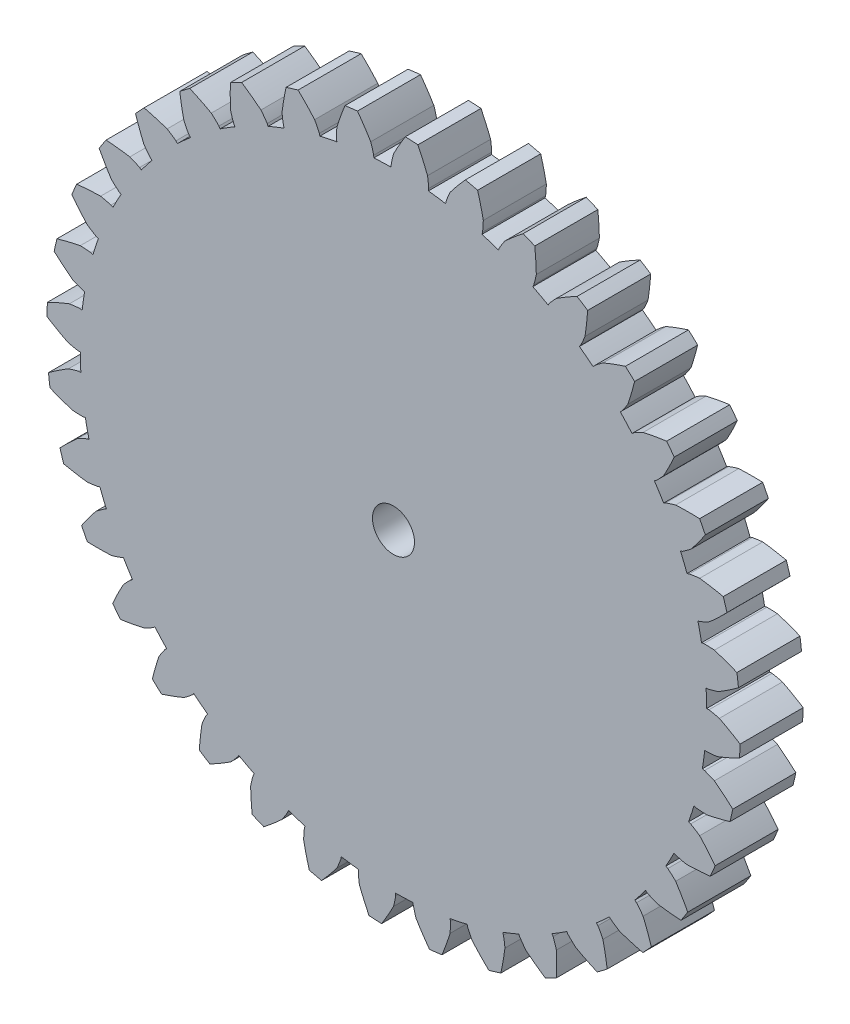
from build123d import *

# Parameters (mm, degrees)
SKETCH1_R           = 1
BOSS_EXTRUDE1_DEPTH = 1.5


with BuildPart() as part:
    # Sketch1 → Boss-Extrude1 (new, symmetric)
    with BuildSketch(Plane.XY):
        with BuildLine():
            Line((-0.105764176, 15.005915709), (-0.105764176, 14.899624624))
            ThreePointArc((-0.105764176, 14.899624624), (-0.520002501, 14.890923323), (-0.933838734, 14.870707623))
            Line((-0.933838734, 14.870707623), (-0.941253225, 14.976739788))
            ThreePointArc((-0.941253225, 14.976739788), (-1.005102521, 15.221260533), (-1.081225343, 15.462242779))
            ThreePointArc((-1.081225343, 15.462242779), (-1.386991056, 15.943446134), (-1.713561409, 16.410780216))
            ThreePointArc((-1.713561409, 16.410780216), (-2.010844166, 16.377011502), (-2.307465746, 16.337857933))
            ThreePointArc((-2.307465746, 16.337857933), (-2.511277217, 15.805401151), (-2.691546754, 15.264520172))
            ThreePointArc((-2.691546754, 15.264520172), (-2.707109521, 15.012280351), (-2.709907298, 14.759576375))
            Line((-2.709907298, 14.759576375), (-2.691450045, 14.65490009))
            ThreePointArc((-2.691450045, 14.65490009), (-3.097884193, 14.574399251), (-3.501922904, 14.482628766))
            Line((-3.501922904, 14.482628766), (-3.527637045, 14.585762551))
            ThreePointArc((-3.527637045, 14.585762551), (-3.632976909, 14.815481162), (-3.749789382, 15.039583757))
            ThreePointArc((-3.749789382, 15.039583757), (-4.134469912, 15.460380893), (-4.53723064, 15.863906774))
            ThreePointArc((-4.53723064, 15.863906774), (-4.824133128, 15.779028473), (-5.109449413, 15.688961938))
            ThreePointArc((-5.109449413, 15.688961938), (-5.21770438, 15.129202881), (-5.301312222, 14.565235622))
            ThreePointArc((-5.301312222, 14.565235622), (-5.27283757, 14.314125445), (-5.231711258, 14.064774781))
            Line((-5.231711258, 14.064774781), (-5.195357565, 13.964893833))
            ThreePointArc((-5.195357565, 13.964893833), (-5.581638242, 13.815039433), (-5.96360292, 13.654502562))
            Line((-5.96360292, 13.654502562), (-6.006835399, 13.7516043))
            ThreePointArc((-6.006835399, 13.7516043), (-6.150465131, 13.959540893), (-6.304417968, 14.159954593))
            ThreePointArc((-6.304417968, 14.159954593), (-6.756324992, 14.507559802), (-7.223038413, 14.835016551))
            ThreePointArc((-7.223038413, 14.835016551), (-7.490843246, 14.701607649), (-7.756185046, 14.563364774))
            ThreePointArc((-7.756185046, 14.563364774), (-7.765594237, 13.993311437), (-7.75, 13.423393759))
            ThreePointArc((-7.75, 13.423393759), (-7.678353117, 13.18104308), (-7.594552318, 12.942622123))
            Line((-7.594552318, 12.942622123), (-7.541406776, 12.850571343))
            ThreePointArc((-7.541406776, 12.850571343), (-7.895797037, 12.635916633), (-8.244081878, 12.411491207))
            Line((-8.244081878, 12.411491207), (-8.303519098, 12.49961051))
            ThreePointArc((-8.303519098, 12.49961051), (-8.481074583, 12.679447038), (-8.667490004, 12.850082375))
            ThreePointArc((-8.667490004, 12.850082375), (-9.172892556, 13.113933848), (-9.689377819, 13.355371858))
            ThreePointArc((-9.689377819, 13.355371858), (-9.929947882, 13.177485916), (-10.167252921, 12.99526714))
            ThreePointArc((-10.167252921, 12.99526714), (-10.077530442, 12.432240305), (-9.96320795, 11.873688868))
            ThreePointArc((-9.96320795, 11.873688868), (-9.850565791, 11.647461392), (-9.726636749, 11.427214441))
            Line((-9.726636749, 11.427214441), (-9.658314157, 11.345790746))
            ThreePointArc((-9.658314157, 11.345790746), (-9.970046035, 11.0728579), (-10.27406858, 10.791362973))
            Line((-10.27406858, 10.791362973), (-10.347904572, 10.86782238))
            ThreePointArc((-10.347904572, 10.86782238), (-10.553990875, 11.014094601), (-10.767204742, 11.149766905))
            ThreePointArc((-10.767204742, 11.149766905), (-11.310746422, 11.321847649), (-11.861310384, 11.469930949))
            ThreePointArc((-11.861310384, 11.469930949), (-12.067336077, 11.252972941), (-12.26939396, 11.032314891))
            ThreePointArc((-12.26939396, 11.032314891), (-12.083265983, 10.493421844), (-11.873688868, 9.96320795))
            ThreePointArc((-11.873688868, 9.96320795), (-11.723474008, 9.759977483), (-11.563182245, 9.56459663))
            Line((-11.563182245, 9.56459663), (-11.48175855, 9.496274038))
            ThreePointArc((-11.48175855, 9.496274038), (-11.741360229, 9.173355982), (-11.991882908, 8.843344635))
            Line((-11.991882908, 8.843344635), (-12.077874201, 8.905820967))
            ThreePointArc((-12.077874201, 8.905820967), (-12.306229495, 9.014084473), (-12.539763413, 9.110671411))
            ThreePointArc((-12.539763413, 9.110671411), (-13.104928981, 9.185752839), (-13.672843034, 9.235981993))
            ThreePointArc((-13.672843034, 9.235981993), (-13.838064371, 8.986544078), (-13.998735673, 8.734151336))
            ThreePointArc((-13.998735673, 8.734151336), (-13.721857603, 8.235766069), (-13.423393759, 7.75))
            ThreePointArc((-13.423393759, 7.75), (-13.240170399, 7.575941597), (-13.048386299, 7.411363391))
            Line((-13.048386299, 7.411363391), (-12.956335519, 7.358217849))
            ThreePointArc((-12.956335519, 7.358217849), (-13.155919134, 6.995126286), (-13.345329941, 6.626625745))
            Line((-13.345329941, 6.626625745), (-13.440863735, 6.67322069))
            ThreePointArc((-13.440863735, 6.67322069), (-13.68454956, 6.74018595), (-13.931307718, 6.794752775))
            ThreePointArc((-13.931307718, 6.794752775), (-14.500924904, 6.770553578), (-15.068933268, 6.721402397))
            ThreePointArc((-15.068933268, 6.721402397), (-15.188330082, 6.44706362), (-15.302732886, 6.170605012))
            ThreePointArc((-15.302732886, 6.170605012), (-14.943517522, 5.72787071), (-14.565235622, 5.301312222))
            ThreePointArc((-14.565235622, 5.301312222), (-14.354570913, 5.16171456), (-14.137121738, 5.032939625))
            Line((-14.137121738, 5.032939625), (-14.037240791, 4.996585933))
            ThreePointArc((-14.037240791, 4.996585933), (-14.170742093, 4.604353216), (-14.293285877, 4.208560186))
            Line((-14.293285877, 4.208560186), (-14.395459425, 4.237857979))
            ThreePointArc((-14.395459425, 4.237857979), (-14.64707151, 4.261490287), (-14.899556287, 4.272379015))
            ThreePointArc((-14.899556287, 4.272379015), (-15.456317562, 4.149634471), (-16.007161589, 4.00259639))
            ThreePointArc((-16.007161589, 4.00259639), (-16.077106069, 3.711692397), (-16.141764304, 3.419567978))
            ThreePointArc((-16.141764304, 3.419567978), (-15.711126224, 3.045936897), (-15.264520172, 2.691546754))
            ThreePointArc((-15.264520172, 2.691546754), (-15.032815053, 2.590651437), (-14.796307888, 2.501592536))
            Line((-14.796307888, 2.501592536), (-14.691631603, 2.483135283))
            ThreePointArc((-14.691631603, 2.483135283), (-14.754994224, 2.073679204), (-14.806947555, 1.662619654))
            Line((-14.806947555, 1.662619654), (-14.912656366, 1.673730098))
            ThreePointArc((-14.912656366, 1.673730098), (-15.164549604, 1.653311398), (-15.415089378, 1.620191181))
            ThreePointArc((-15.415089378, 1.620191181), (-15.942077832, 1.402630822), (-16.459020406, 1.162173517))
            ThreePointArc((-16.459020406, 1.162173517), (-16.477387323, 0.863543278), (-16.490336382, 0.564629101))
            ThreePointArc((-16.490336382, 0.564629101), (-16.001360306, 0.271453834), (-15.5, 0))
            ThreePointArc((-15.5, 0), (-15.254294715, -0.059127319), (-15.005915709, -0.105764176))
            Line((-15.005915709, -0.105764176), (-14.899624624, -0.105764176))
            ThreePointArc((-14.899624624, -0.105764176), (-14.890923323, -0.520002501), (-14.870707623, -0.933838734))
            Line((-14.870707623, -0.933838734), (-14.976739788, -0.941253225))
            ThreePointArc((-14.976739788, -0.941253225), (-15.221260533, -1.005102521), (-15.462242779, -1.081225343))
            ThreePointArc((-15.462242779, -1.081225343), (-15.943446134, -1.386991056), (-16.410780216, -1.713561409))
            ThreePointArc((-16.410780216, -1.713561409), (-16.377011502, -2.010844166), (-16.337857933, -2.307465746))
            ThreePointArc((-16.337857933, -2.307465746), (-15.805401151, -2.511277217), (-15.264520172, -2.691546754))
            ThreePointArc((-15.264520172, -2.691546754), (-15.012280351, -2.707109521), (-14.759576375, -2.709907298))
            Line((-14.759576375, -2.709907298), (-14.65490009, -2.691450045))
            ThreePointArc((-14.65490009, -2.691450045), (-14.574399251, -3.097884193), (-14.482628766, -3.501922904))
            Line((-14.482628766, -3.501922904), (-14.585762551, -3.527637045))
            ThreePointArc((-14.585762551, -3.527637045), (-14.815481162, -3.632976909), (-15.039583757, -3.749789382))
            ThreePointArc((-15.039583757, -3.749789382), (-15.460380893, -4.134469912), (-15.863906774, -4.53723064))
            ThreePointArc((-15.863906774, -4.53723064), (-15.779028473, -4.824133128), (-15.688961938, -5.109449413))
            ThreePointArc((-15.688961938, -5.109449413), (-15.129202881, -5.21770438), (-14.565235622, -5.301312222))
            ThreePointArc((-14.565235622, -5.301312222), (-14.314125445, -5.27283757), (-14.064774781, -5.231711258))
            Line((-14.064774781, -5.231711258), (-13.964893833, -5.195357565))
            ThreePointArc((-13.964893833, -5.195357565), (-13.815039433, -5.581638242), (-13.654502562, -5.96360292))
            Line((-13.654502562, -5.96360292), (-13.7516043, -6.006835399))
            ThreePointArc((-13.7516043, -6.006835399), (-13.959540893, -6.150465131), (-14.159954593, -6.304417968))
            ThreePointArc((-14.159954593, -6.304417968), (-14.507559802, -6.756324992), (-14.835016551, -7.223038413))
            ThreePointArc((-14.835016551, -7.223038413), (-14.701607649, -7.490843246), (-14.563364774, -7.756185046))
            ThreePointArc((-14.563364774, -7.756185046), (-13.993311437, -7.765594237), (-13.423393759, -7.75))
            ThreePointArc((-13.423393759, -7.75), (-13.18104308, -7.678353117), (-12.942622123, -7.594552318))
            Line((-12.942622123, -7.594552318), (-12.850571343, -7.541406776))
            ThreePointArc((-12.850571343, -7.541406776), (-12.635916633, -7.895797037), (-12.411491207, -8.244081878))
            Line((-12.411491207, -8.244081878), (-12.49961051, -8.303519098))
            ThreePointArc((-12.49961051, -8.303519098), (-12.679447038, -8.481074583), (-12.850082375, -8.667490004))
            ThreePointArc((-12.850082375, -8.667490004), (-13.113933848, -9.172892556), (-13.355371858, -9.689377819))
            ThreePointArc((-13.355371858, -9.689377819), (-13.177485916, -9.929947882), (-12.99526714, -10.167252921))
            ThreePointArc((-12.99526714, -10.167252921), (-12.432240305, -10.077530442), (-11.873688868, -9.96320795))
            ThreePointArc((-11.873688868, -9.96320795), (-11.647461392, -9.850565791), (-11.427214441, -9.726636749))
            Line((-11.427214441, -9.726636749), (-11.345790746, -9.658314157))
            ThreePointArc((-11.345790746, -9.658314157), (-11.0728579, -9.970046035), (-10.791362973, -10.27406858))
            Line((-10.791362973, -10.27406858), (-10.86782238, -10.347904572))
            ThreePointArc((-10.86782238, -10.347904572), (-11.014094601, -10.553990875), (-11.149766905, -10.767204742))
            ThreePointArc((-11.149766905, -10.767204742), (-11.321847649, -11.310746422), (-11.469930949, -11.861310384))
            ThreePointArc((-11.469930949, -11.861310384), (-11.252972941, -12.067336077), (-11.032314891, -12.26939396))
            ThreePointArc((-11.032314891, -12.26939396), (-10.493421844, -12.083265983), (-9.96320795, -11.873688868))
            ThreePointArc((-9.96320795, -11.873688868), (-9.759977483, -11.723474008), (-9.56459663, -11.563182245))
            Line((-9.56459663, -11.563182245), (-9.496274038, -11.48175855))
            ThreePointArc((-9.496274038, -11.48175855), (-9.173355982, -11.741360229), (-8.843344635, -11.991882908))
            Line((-8.843344635, -11.991882908), (-8.905820967, -12.077874201))
            ThreePointArc((-8.905820967, -12.077874201), (-9.014084473, -12.306229495), (-9.110671411, -12.539763413))
            ThreePointArc((-9.110671411, -12.539763413), (-9.185752839, -13.104928981), (-9.235981993, -13.672843034))
            ThreePointArc((-9.235981993, -13.672843034), (-8.986544078, -13.838064371), (-8.734151336, -13.998735673))
            ThreePointArc((-8.734151336, -13.998735673), (-8.235766069, -13.721857603), (-7.75, -13.423393759))
            ThreePointArc((-7.75, -13.423393759), (-7.575941597, -13.240170399), (-7.411363391, -13.048386299))
            Line((-7.411363391, -13.048386299), (-7.358217849, -12.956335519))
            ThreePointArc((-7.358217849, -12.956335519), (-6.995126286, -13.155919134), (-6.626625745, -13.345329941))
            Line((-6.626625745, -13.345329941), (-6.67322069, -13.440863735))
            ThreePointArc((-6.67322069, -13.440863735), (-6.74018595, -13.68454956), (-6.794752775, -13.931307718))
            ThreePointArc((-6.794752775, -13.931307718), (-6.770553578, -14.500924904), (-6.721402397, -15.068933268))
            ThreePointArc((-6.721402397, -15.068933268), (-6.44706362, -15.188330082), (-6.170605012, -15.302732886))
            ThreePointArc((-6.170605012, -15.302732886), (-5.72787071, -14.943517522), (-5.301312222, -14.565235622))
            ThreePointArc((-5.301312222, -14.565235622), (-5.16171456, -14.354570913), (-5.032939625, -14.137121738))
            Line((-5.032939625, -14.137121738), (-4.996585933, -14.037240791))
            ThreePointArc((-4.996585933, -14.037240791), (-4.604353216, -14.170742093), (-4.208560186, -14.293285877))
            Line((-4.208560186, -14.293285877), (-4.237857979, -14.395459425))
            ThreePointArc((-4.237857979, -14.395459425), (-4.261490287, -14.64707151), (-4.272379015, -14.899556287))
            ThreePointArc((-4.272379015, -14.899556287), (-4.149634471, -15.456317562), (-4.00259639, -16.007161589))
            ThreePointArc((-4.00259639, -16.007161589), (-3.711692397, -16.077106069), (-3.419567978, -16.141764304))
            ThreePointArc((-3.419567978, -16.141764304), (-3.045936897, -15.711126224), (-2.691546754, -15.264520172))
            ThreePointArc((-2.691546754, -15.264520172), (-2.590651437, -15.032815053), (-2.501592536, -14.796307888))
            Line((-2.501592536, -14.796307888), (-2.483135283, -14.691631603))
            ThreePointArc((-2.483135283, -14.691631603), (-2.073679204, -14.754994224), (-1.662619654, -14.806947555))
            Line((-1.662619654, -14.806947555), (-1.673730098, -14.912656366))
            ThreePointArc((-1.673730098, -14.912656366), (-1.653311398, -15.164549604), (-1.620191181, -15.415089378))
            ThreePointArc((-1.620191181, -15.415089378), (-1.402630822, -15.942077832), (-1.162173517, -16.459020406))
            ThreePointArc((-1.162173517, -16.459020406), (-0.863543278, -16.477387323), (-0.564629101, -16.490336382))
            ThreePointArc((-0.564629101, -16.490336382), (-0.271453834, -16.001360306), (0, -15.5))
            ThreePointArc((0, -15.5), (0.059127319, -15.254294715), (0.105764176, -15.005915709))
            Line((0.105764176, -15.005915709), (0.105764176, -14.899624624))
            ThreePointArc((0.105764176, -14.899624624), (0.520002501, -14.890923323), (0.933838734, -14.870707623))
            Line((0.933838734, -14.870707623), (0.941253225, -14.976739788))
            ThreePointArc((0.941253225, -14.976739788), (1.005102521, -15.221260533), (1.081225343, -15.462242779))
            ThreePointArc((1.081225343, -15.462242779), (1.386991056, -15.943446134), (1.713561409, -16.410780216))
            ThreePointArc((1.713561409, -16.410780216), (2.010844166, -16.377011502), (2.307465746, -16.337857933))
            ThreePointArc((2.307465746, -16.337857933), (2.511277217, -15.805401151), (2.691546754, -15.264520172))
            ThreePointArc((2.691546754, -15.264520172), (2.707109521, -15.012280351), (2.709907298, -14.759576375))
            Line((2.709907298, -14.759576375), (2.691450045, -14.65490009))
            ThreePointArc((2.691450045, -14.65490009), (3.097884193, -14.574399251), (3.501922904, -14.482628766))
            Line((3.501922904, -14.482628766), (3.527637045, -14.585762551))
            ThreePointArc((3.527637045, -14.585762551), (3.632976909, -14.815481162), (3.749789382, -15.039583757))
            ThreePointArc((3.749789382, -15.039583757), (4.134469912, -15.460380893), (4.53723064, -15.863906774))
            ThreePointArc((4.53723064, -15.863906774), (4.824133128, -15.779028473), (5.109449413, -15.688961938))
            ThreePointArc((5.109449413, -15.688961938), (5.21770438, -15.129202881), (5.301312222, -14.565235622))
            ThreePointArc((5.301312222, -14.565235622), (5.27283757, -14.314125445), (5.231711258, -14.064774781))
            Line((5.231711258, -14.064774781), (5.195357565, -13.964893833))
            ThreePointArc((5.195357565, -13.964893833), (5.581638242, -13.815039433), (5.96360292, -13.654502562))
            Line((5.96360292, -13.654502562), (6.006835399, -13.7516043))
            ThreePointArc((6.006835399, -13.7516043), (6.150465131, -13.959540893), (6.304417968, -14.159954593))
            ThreePointArc((6.304417968, -14.159954593), (6.756324992, -14.507559802), (7.223038413, -14.835016551))
            ThreePointArc((7.223038413, -14.835016551), (7.490843246, -14.701607649), (7.756185046, -14.563364774))
            ThreePointArc((7.756185046, -14.563364774), (7.765594237, -13.993311437), (7.75, -13.423393759))
            ThreePointArc((7.75, -13.423393759), (7.678353117, -13.18104308), (7.594552318, -12.942622123))
            Line((7.594552318, -12.942622123), (7.541406776, -12.850571343))
            ThreePointArc((7.541406776, -12.850571343), (7.895797037, -12.635916633), (8.244081878, -12.411491207))
            Line((8.244081878, -12.411491207), (8.303519098, -12.49961051))
            ThreePointArc((8.303519098, -12.49961051), (8.481074583, -12.679447038), (8.667490004, -12.850082375))
            ThreePointArc((8.667490004, -12.850082375), (9.172892556, -13.113933848), (9.689377819, -13.355371858))
            ThreePointArc((9.689377819, -13.355371858), (9.929947882, -13.177485916), (10.167252921, -12.99526714))
            ThreePointArc((10.167252921, -12.99526714), (10.077530442, -12.432240305), (9.96320795, -11.873688868))
            ThreePointArc((9.96320795, -11.873688868), (9.850565791, -11.647461392), (9.726636749, -11.427214441))
            Line((9.726636749, -11.427214441), (9.658314157, -11.345790746))
            ThreePointArc((9.658314157, -11.345790746), (9.970046035, -11.0728579), (10.27406858, -10.791362973))
            Line((10.27406858, -10.791362973), (10.347904572, -10.86782238))
            ThreePointArc((10.347904572, -10.86782238), (10.553990875, -11.014094601), (10.767204742, -11.149766905))
            ThreePointArc((10.767204742, -11.149766905), (11.310746422, -11.321847649), (11.861310384, -11.469930949))
            ThreePointArc((11.861310384, -11.469930949), (12.067336077, -11.252972941), (12.26939396, -11.032314891))
            ThreePointArc((12.26939396, -11.032314891), (12.083265983, -10.493421844), (11.873688868, -9.96320795))
            ThreePointArc((11.873688868, -9.96320795), (11.723474008, -9.759977483), (11.563182245, -9.56459663))
            Line((11.563182245, -9.56459663), (11.48175855, -9.496274038))
            ThreePointArc((11.48175855, -9.496274038), (11.741360229, -9.173355982), (11.991882908, -8.843344635))
            Line((11.991882908, -8.843344635), (12.077874201, -8.905820967))
            ThreePointArc((12.077874201, -8.905820967), (12.306229495, -9.014084473), (12.539763413, -9.110671411))
            ThreePointArc((12.539763413, -9.110671411), (13.104928981, -9.185752839), (13.672843034, -9.235981993))
            ThreePointArc((13.672843034, -9.235981993), (13.838064371, -8.986544078), (13.998735673, -8.734151336))
            ThreePointArc((13.998735673, -8.734151336), (13.721857603, -8.235766069), (13.423393759, -7.75))
            ThreePointArc((13.423393759, -7.75), (13.240170399, -7.575941597), (13.048386299, -7.411363391))
            Line((13.048386299, -7.411363391), (12.956335519, -7.358217849))
            ThreePointArc((12.956335519, -7.358217849), (13.155919134, -6.995126286), (13.345329941, -6.626625745))
            Line((13.345329941, -6.626625745), (13.440863735, -6.67322069))
            ThreePointArc((13.440863735, -6.67322069), (13.68454956, -6.74018595), (13.931307718, -6.794752775))
            ThreePointArc((13.931307718, -6.794752775), (14.500924904, -6.770553578), (15.068933268, -6.721402397))
            ThreePointArc((15.068933268, -6.721402397), (15.188330082, -6.44706362), (15.302732886, -6.170605012))
            ThreePointArc((15.302732886, -6.170605012), (14.943517522, -5.72787071), (14.565235622, -5.301312222))
            ThreePointArc((14.565235622, -5.301312222), (14.354570913, -5.16171456), (14.137121738, -5.032939625))
            Line((14.137121738, -5.032939625), (14.037240791, -4.996585933))
            ThreePointArc((14.037240791, -4.996585933), (14.170742093, -4.604353216), (14.293285877, -4.208560186))
            Line((14.293285877, -4.208560186), (14.395459425, -4.237857979))
            ThreePointArc((14.395459425, -4.237857979), (14.64707151, -4.261490287), (14.899556287, -4.272379015))
            ThreePointArc((14.899556287, -4.272379015), (15.456317562, -4.149634471), (16.007161589, -4.00259639))
            ThreePointArc((16.007161589, -4.00259639), (16.077106069, -3.711692397), (16.141764304, -3.419567978))
            ThreePointArc((16.141764304, -3.419567978), (15.711126224, -3.045936897), (15.264520172, -2.691546754))
            ThreePointArc((15.264520172, -2.691546754), (15.032815053, -2.590651437), (14.796307888, -2.501592536))
            Line((14.796307888, -2.501592536), (14.691631603, -2.483135283))
            ThreePointArc((14.691631603, -2.483135283), (14.754994224, -2.073679204), (14.806947555, -1.662619654))
            Line((14.806947555, -1.662619654), (14.912656366, -1.673730098))
            ThreePointArc((14.912656366, -1.673730098), (15.164549604, -1.653311398), (15.415089378, -1.620191181))
            ThreePointArc((15.415089378, -1.620191181), (15.942077832, -1.402630822), (16.459020406, -1.162173517))
            ThreePointArc((16.459020406, -1.162173517), (16.477387323, -0.863543278), (16.490336382, -0.564629101))
            ThreePointArc((16.490336382, -0.564629101), (16.001360306, -0.271453834), (15.5, 0))
            ThreePointArc((15.5, 0), (15.254294715, 0.059127319), (15.005915709, 0.105764176))
            Line((15.005915709, 0.105764176), (14.899624624, 0.105764176))
            ThreePointArc((14.899624624, 0.105764176), (14.890923323, 0.520002501), (14.870707623, 0.933838734))
            Line((14.870707623, 0.933838734), (14.976739788, 0.941253225))
            ThreePointArc((14.976739788, 0.941253225), (15.221260533, 1.005102521), (15.462242779, 1.081225343))
            ThreePointArc((15.462242779, 1.081225343), (15.943446134, 1.386991056), (16.410780216, 1.713561409))
            ThreePointArc((16.410780216, 1.713561409), (16.377011502, 2.010844166), (16.337857933, 2.307465746))
            ThreePointArc((16.337857933, 2.307465746), (15.805401151, 2.511277217), (15.264520172, 2.691546754))
            ThreePointArc((15.264520172, 2.691546754), (15.012280351, 2.707109521), (14.759576375, 2.709907298))
            Line((14.759576375, 2.709907298), (14.65490009, 2.691450045))
            ThreePointArc((14.65490009, 2.691450045), (14.574399251, 3.097884193), (14.482628766, 3.501922904))
            Line((14.482628766, 3.501922904), (14.585762551, 3.527637045))
            ThreePointArc((14.585762551, 3.527637045), (14.815481162, 3.632976909), (15.039583757, 3.749789382))
            ThreePointArc((15.039583757, 3.749789382), (15.460380893, 4.134469912), (15.863906774, 4.53723064))
            ThreePointArc((15.863906774, 4.53723064), (15.779028473, 4.824133128), (15.688961938, 5.109449413))
            ThreePointArc((15.688961938, 5.109449413), (15.129202881, 5.21770438), (14.565235622, 5.301312222))
            ThreePointArc((14.565235622, 5.301312222), (14.314125445, 5.27283757), (14.064774781, 5.231711258))
            Line((14.064774781, 5.231711258), (13.964893833, 5.195357565))
            ThreePointArc((13.964893833, 5.195357565), (13.815039433, 5.581638242), (13.654502562, 5.96360292))
            Line((13.654502562, 5.96360292), (13.7516043, 6.006835399))
            ThreePointArc((13.7516043, 6.006835399), (13.959540893, 6.150465131), (14.159954593, 6.304417968))
            ThreePointArc((14.159954593, 6.304417968), (14.507559802, 6.756324992), (14.835016551, 7.223038413))
            ThreePointArc((14.835016551, 7.223038413), (14.701607649, 7.490843246), (14.563364774, 7.756185046))
            ThreePointArc((14.563364774, 7.756185046), (13.993311437, 7.765594237), (13.423393759, 7.75))
            ThreePointArc((13.423393759, 7.75), (13.18104308, 7.678353117), (12.942622123, 7.594552318))
            Line((12.942622123, 7.594552318), (12.850571343, 7.541406776))
            ThreePointArc((12.850571343, 7.541406776), (12.635916633, 7.895797037), (12.411491207, 8.244081878))
            Line((12.411491207, 8.244081878), (12.49961051, 8.303519098))
            ThreePointArc((12.49961051, 8.303519098), (12.679447038, 8.481074583), (12.850082375, 8.667490004))
            ThreePointArc((12.850082375, 8.667490004), (13.113933848, 9.172892556), (13.355371858, 9.689377819))
            ThreePointArc((13.355371858, 9.689377819), (13.177485916, 9.929947882), (12.99526714, 10.167252921))
            ThreePointArc((12.99526714, 10.167252921), (12.432240305, 10.077530442), (11.873688868, 9.96320795))
            ThreePointArc((11.873688868, 9.96320795), (11.647461392, 9.850565791), (11.427214441, 9.726636749))
            Line((11.427214441, 9.726636749), (11.345790746, 9.658314157))
            ThreePointArc((11.345790746, 9.658314157), (11.0728579, 9.970046035), (10.791362973, 10.27406858))
            Line((10.791362973, 10.27406858), (10.86782238, 10.347904572))
            ThreePointArc((10.86782238, 10.347904572), (11.014094601, 10.553990875), (11.149766905, 10.767204742))
            ThreePointArc((11.149766905, 10.767204742), (11.321847649, 11.310746422), (11.469930949, 11.861310384))
            ThreePointArc((11.469930949, 11.861310384), (11.252972941, 12.067336077), (11.032314891, 12.26939396))
            ThreePointArc((11.032314891, 12.26939396), (10.493421844, 12.083265983), (9.96320795, 11.873688868))
            ThreePointArc((9.96320795, 11.873688868), (9.759977483, 11.723474008), (9.56459663, 11.563182245))
            Line((9.56459663, 11.563182245), (9.496274038, 11.48175855))
            ThreePointArc((9.496274038, 11.48175855), (9.173355982, 11.741360229), (8.843344635, 11.991882908))
            Line((8.843344635, 11.991882908), (8.905820967, 12.077874201))
            ThreePointArc((8.905820967, 12.077874201), (9.014084473, 12.306229495), (9.110671411, 12.539763413))
            ThreePointArc((9.110671411, 12.539763413), (9.185752839, 13.104928981), (9.235981993, 13.672843034))
            ThreePointArc((9.235981993, 13.672843034), (8.986544078, 13.838064371), (8.734151336, 13.998735673))
            ThreePointArc((8.734151336, 13.998735673), (8.235766069, 13.721857603), (7.75, 13.423393759))
            ThreePointArc((7.75, 13.423393759), (7.575941597, 13.240170399), (7.411363391, 13.048386299))
            Line((7.411363391, 13.048386299), (7.358217849, 12.956335519))
            ThreePointArc((7.358217849, 12.956335519), (6.995126286, 13.155919134), (6.626625745, 13.345329941))
            Line((6.626625745, 13.345329941), (6.67322069, 13.440863735))
            ThreePointArc((6.67322069, 13.440863735), (6.74018595, 13.68454956), (6.794752775, 13.931307718))
            ThreePointArc((6.794752775, 13.931307718), (6.770553578, 14.500924904), (6.721402397, 15.068933268))
            ThreePointArc((6.721402397, 15.068933268), (6.44706362, 15.188330082), (6.170605012, 15.302732886))
            ThreePointArc((6.170605012, 15.302732886), (5.72787071, 14.943517522), (5.301312222, 14.565235622))
            ThreePointArc((5.301312222, 14.565235622), (5.16171456, 14.354570913), (5.032939625, 14.137121738))
            Line((5.032939625, 14.137121738), (4.996585933, 14.037240791))
            ThreePointArc((4.996585933, 14.037240791), (4.604353216, 14.170742093), (4.208560186, 14.293285877))
            Line((4.208560186, 14.293285877), (4.237857979, 14.395459425))
            ThreePointArc((4.237857979, 14.395459425), (4.261490287, 14.64707151), (4.272379015, 14.899556287))
            ThreePointArc((4.272379015, 14.899556287), (4.149634471, 15.456317562), (4.00259639, 16.007161589))
            ThreePointArc((4.00259639, 16.007161589), (3.711692397, 16.077106069), (3.419567978, 16.141764304))
            ThreePointArc((3.419567978, 16.141764304), (3.045936897, 15.711126224), (2.691546754, 15.264520172))
            ThreePointArc((2.691546754, 15.264520172), (2.590651437, 15.032815053), (2.501592536, 14.796307888))
            Line((2.501592536, 14.796307888), (2.483135283, 14.691631603))
            ThreePointArc((2.483135283, 14.691631603), (2.073679204, 14.754994224), (1.662619654, 14.806947555))
            Line((1.662619654, 14.806947555), (1.673730098, 14.912656366))
            ThreePointArc((1.673730098, 14.912656366), (1.653311398, 15.164549604), (1.620191181, 15.415089378))
            ThreePointArc((1.620191181, 15.415089378), (1.402630822, 15.942077832), (1.162173517, 16.459020406))
            ThreePointArc((1.162173517, 16.459020406), (0.863543278, 16.477387323), (0.564629101, 16.490336382))
            ThreePointArc((0.564629101, 16.490336382), (0.271453834, 16.001360306), (0, 15.5))
            ThreePointArc((0, 15.5), (-0.059127319, 15.254294715), (-0.105764176, 15.005915709))
        make_face()
        Circle(SKETCH1_R, mode=Mode.SUBTRACT)
    extrude(amount=BOSS_EXTRUDE1_DEPTH, both=True)


solid = part.part
